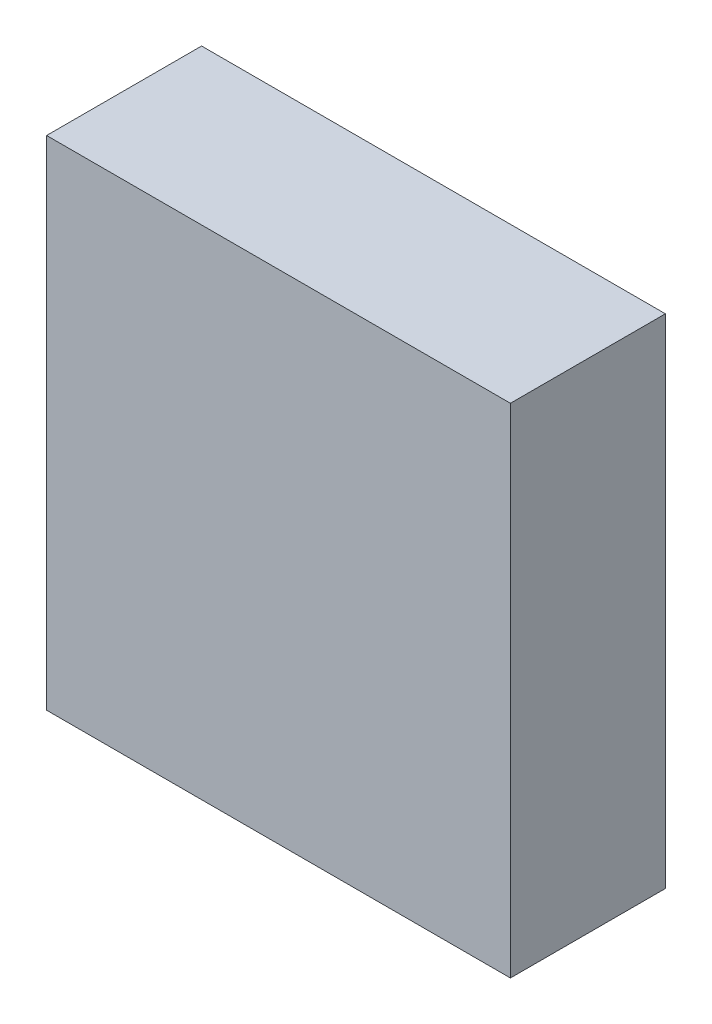
from build123d import *

# Parameters (mm, degrees)
SKETCH1_W           = 205
SKETCH1_H           = 220
BOSS_EXTRUDE1_DEPTH = 68.5


with BuildPart() as part:
    # Sketch1 → Boss-Extrude1 (new body)
    with BuildSketch(Plane.XY):
        Rectangle(SKETCH1_W, SKETCH1_H)
    extrude(amount=BOSS_EXTRUDE1_DEPTH)


solid = part.part
